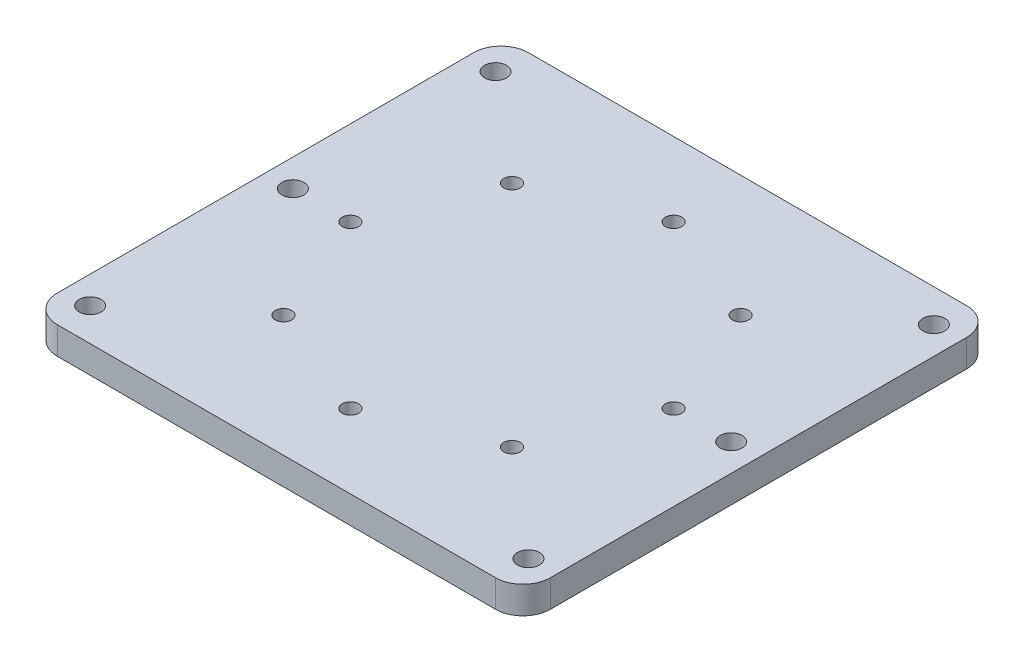
from build123d import *

# Parameters (mm, degrees)
SKETCH_1_W      = 90
SKETCH_1_H      = 86
SKETCH_1_R      = 1.5
SKETCH_1_R_2    = 2
EXTRUDE_1_DEPTH = 5
FILLET_1_R      = 5


with BuildPart() as part:
    # 草图1 → 凸台-拉伸1 (new body)
    with BuildSketch(Plane(origin=(0, 0, 0), x_dir=(1, 0, 0), z_dir=(0, 1, 0))):
        Rectangle(SKETCH_1_W, SKETCH_1_H)
        with Locations(Location((0, 29.5, 0), (0, 0, 270))):
            Circle(SKETCH_1_R, mode=Mode.SUBTRACT)
        with Locations(Location((20.859650045, 20.859650045, 0), (0, 0, 270))):
            Circle(SKETCH_1_R, mode=Mode.SUBTRACT)
        with Locations(Location((29.5, 0, 0), (0, 0, 270))):
            Circle(SKETCH_1_R, mode=Mode.SUBTRACT)
        with Locations(Location((20.859650045, -20.859650045, 0), (0, 0, 270))):
            Circle(SKETCH_1_R, mode=Mode.SUBTRACT)
        with Locations(Location((0, -29.5, 0), (0, 0, 270))):
            Circle(SKETCH_1_R, mode=Mode.SUBTRACT)
        with Locations(Location((-20.859650045, -20.859650045, 0), (0, 0, 270))):
            Circle(SKETCH_1_R, mode=Mode.SUBTRACT)
        with Locations(Location((-29.5, 0, 0), (0, 0, 270))):
            Circle(SKETCH_1_R, mode=Mode.SUBTRACT)
        with Locations(Location((-20.859650045, 20.859650045, 0), (0, 0, 270))):
            Circle(SKETCH_1_R, mode=Mode.SUBTRACT)
        with Locations(Location((-40, 0, 0), (0, 0, 270))):
            Circle(SKETCH_1_R_2, mode=Mode.SUBTRACT)
        with Locations(Location((40, 0, 0), (0, 0, 90))):
            Circle(SKETCH_1_R_2, mode=Mode.SUBTRACT)
        with Locations(Location((-40, 37, 0), (0, 0, 270))):
            Circle(SKETCH_1_R_2, mode=Mode.SUBTRACT)
        with Locations(Location((40, 37, 0), (0, 0, 90))):
            Circle(SKETCH_1_R_2, mode=Mode.SUBTRACT)
        with Locations(Location((40, -37, 0), (0, 0, 270))):
            Circle(SKETCH_1_R_2, mode=Mode.SUBTRACT)
        with Locations(Location((-40, -37, 0), (0, 0, 90))):
            Circle(SKETCH_1_R_2, mode=Mode.SUBTRACT)
    extrude(amount=EXTRUDE_1_DEPTH)

    # 圆角1
    fillet_1_edges = [part.edges().sort_by_distance(p)[0] for p in [
        (-45, 2.5, -43),
        (45, 2.5, -43),
        (45, 2.5, 43),
        (-45, 2.5, 43),
    ]]
    fillet(fillet_1_edges, radius=FILLET_1_R)


solid = part.part
